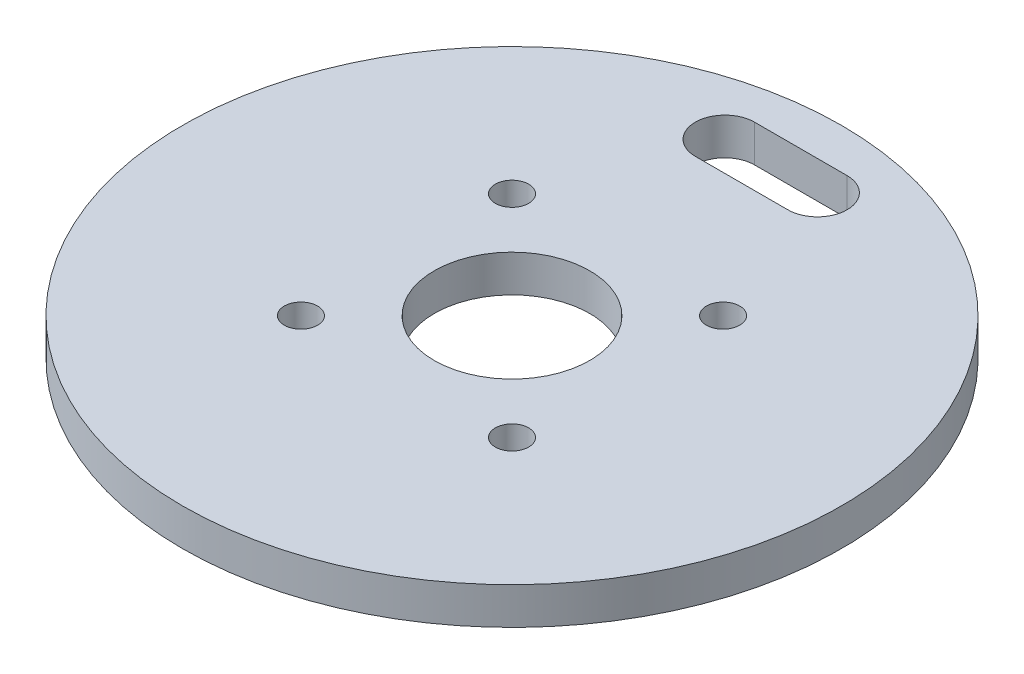
from build123d import *

# Parameters (mm, degrees)
SKETCH1_R            = 44.5
SKETCH1_R_2          = 10.5
BODY_DEPTH           = 5
WIRE_HOLE_DEPTH      = 64.130816564
M4_CLEARANCE_HOLE1_D = 4.5


with BuildPart() as part:
    # Sketch1 → Body (new body)
    with BuildSketch(Plane(origin=(0, 0, 0), x_dir=(1, 0, 0), z_dir=(0, 1, 0))):
        with Locations(Location((0, 0, 0), (0, 0, 270))):
            Circle(SKETCH1_R)
        with Locations(Location((0, 0, 0), (0, 0, 270))):
            Circle(SKETCH1_R_2, mode=Mode.SUBTRACT)
    extrude(amount=BODY_DEPTH)

    # Sketch5 → Wire_Hole (cut, through all)
    with BuildSketch(Plane(origin=(0, 5, 0), x_dir=(1, 0, 0), z_dir=(0, 1, 0))):
        with BuildLine():
            Line((-6.25, 39), (6.25, 39))
            ThreePointArc((6.25, 39), (10.25, 35), (6.25, 31))
            Line((6.25, 31), (-6.25, 31))
            ThreePointArc((-6.25, 31), (-10.25, 35), (-6.25, 39))
        make_face()
    extrude(amount=-WIRE_HOLE_DEPTH, mode=Mode.SUBTRACT)

    # M4 Clearance Hole1 (through all)
    with Locations(Plane(origin=(0, 5, 0), x_dir=(1, 0, 0), z_dir=(0, 1, 0))):
        with Locations((-14.25, 14.25), (14.25, -14.25), (14.25, 14.25), (-14.25, -14.25)):
            Hole(M4_CLEARANCE_HOLE1_D / 2)


solid = part.part
